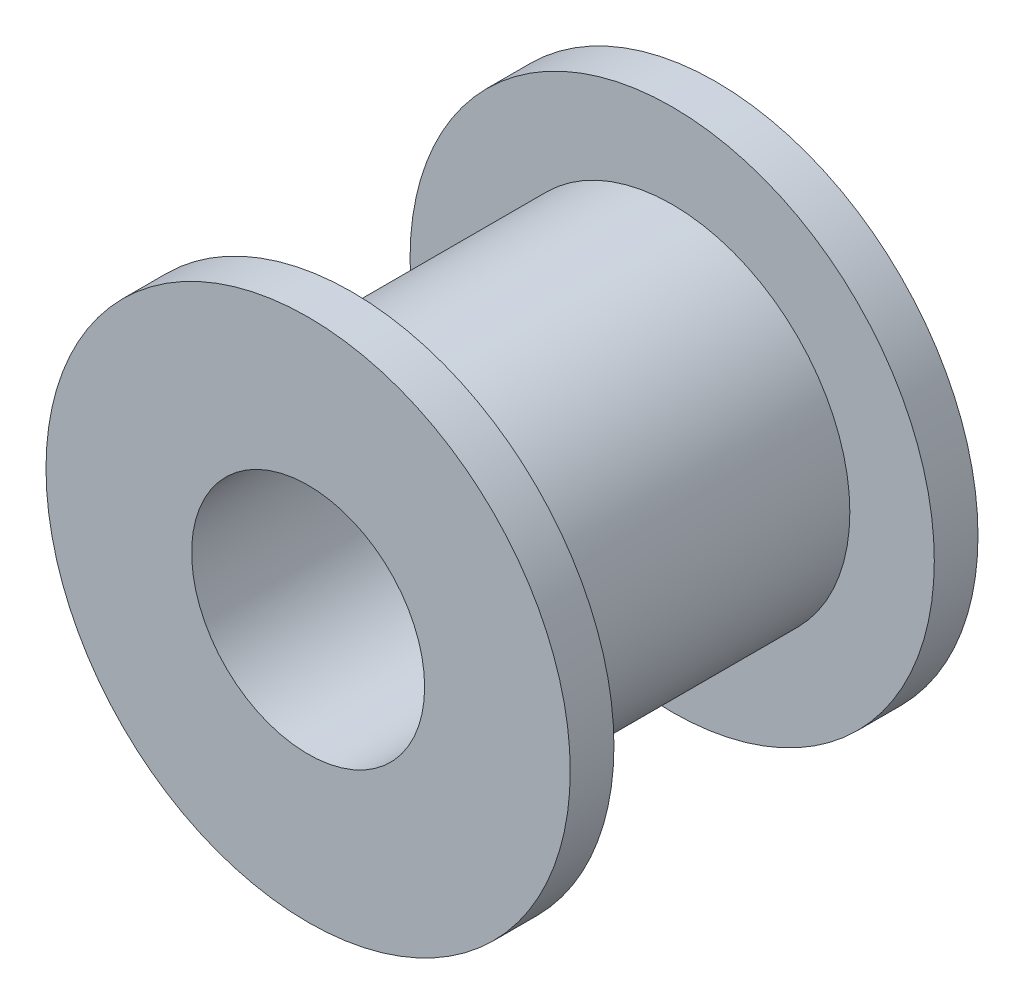
from build123d import *

# Parameters (mm, degrees)
SKETCH2_R           = 9
BOSS_EXTRUDE1_DEPTH = 1.5
SKETCH3_R           = 6.1
BOSS_EXTRUDE2_DEPTH = 11
SKETCH4_R           = 9
BOSS_EXTRUDE3_DEPTH = 1.5
SKETCH5_R           = 4
CUT_EXTRUDE1_DEPTH  = 20


with BuildPart() as part:
    # Sketch2 → Boss-Extrude1 (new body)
    with BuildSketch(Plane.XY):
        Circle(SKETCH2_R)
    extrude(amount=BOSS_EXTRUDE1_DEPTH)

    # Sketch3 → Boss-Extrude2 (add)
    with BuildSketch(Plane.XY.offset(1.5)):
        Circle(SKETCH3_R)
    extrude(amount=BOSS_EXTRUDE2_DEPTH)

    # Sketch4 → Boss-Extrude3 (add)
    with BuildSketch(Plane.XY.offset(12.5)):
        Circle(SKETCH4_R)
    extrude(amount=BOSS_EXTRUDE3_DEPTH)

    # Sketch5 → Cut-Extrude1 (cut)
    with BuildSketch(Plane.XY.offset(14)):
        Circle(SKETCH5_R)
    extrude(amount=-CUT_EXTRUDE1_DEPTH, mode=Mode.SUBTRACT)


solid = part.part
